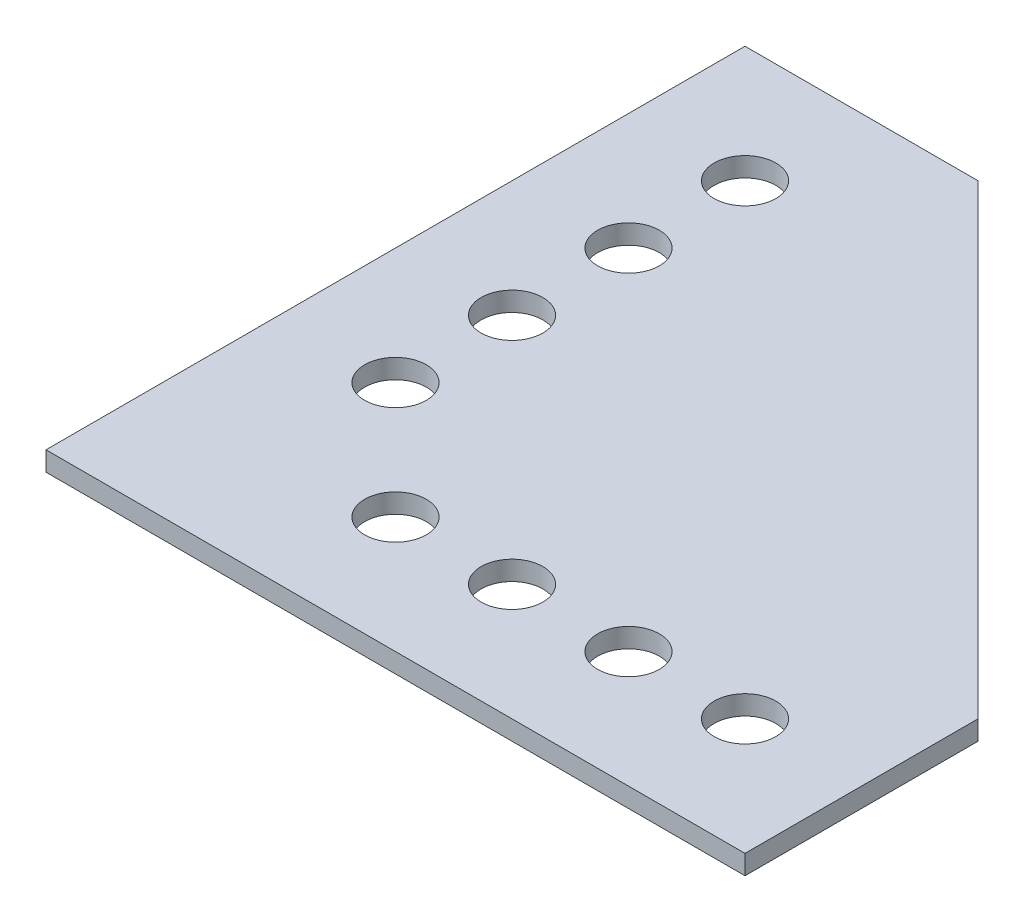
from build123d import *

# Parameters (mm, degrees)
BOSS_EXTRUDE1_DEPTH         = 3.175
F_3_8_CLEARANCE_HOLE1_D     = 10.0838
F_3_8_CLEARANCE_HOLE1_DEPTH = 3.175
F_3_8_CLEARANCE_HOLE1_TIP   = 3.029479155


with BuildPart() as part:
    # Sketch1 → Boss-Extrude1 (new body)
    with BuildSketch(Plane(origin=(0, 0, 0), x_dir=(1, 0, 0), z_dir=(0, 1, 0))):
        Polygon((0, 0), (38.1, 0), (114.3, -76.2), (114.3, -114.3), (0, -114.3), align=None)
    extrude(amount=BOSS_EXTRUDE1_DEPTH)

    # 3/8 Clearance Hole1
    with Locations(Plane(origin=(0, 3.175, 0), x_dir=(1, 0, 0), z_dir=(0, 1, 0))):
        with Locations((19.05, -19.05), (19.05, -38.1), (19.05, -57.15), (19.05, -76.2), (38.1, -95.25), (57.15, -95.25), (76.2, -95.25), (95.25, -95.25)):
            Hole(F_3_8_CLEARANCE_HOLE1_D / 2, depth=F_3_8_CLEARANCE_HOLE1_DEPTH)
            with Locations((0, 0, -(F_3_8_CLEARANCE_HOLE1_DEPTH + F_3_8_CLEARANCE_HOLE1_TIP / 2))):  # 118° drill point
                Cone(0, F_3_8_CLEARANCE_HOLE1_D / 2, F_3_8_CLEARANCE_HOLE1_TIP, mode=Mode.SUBTRACT)


solid = part.part
